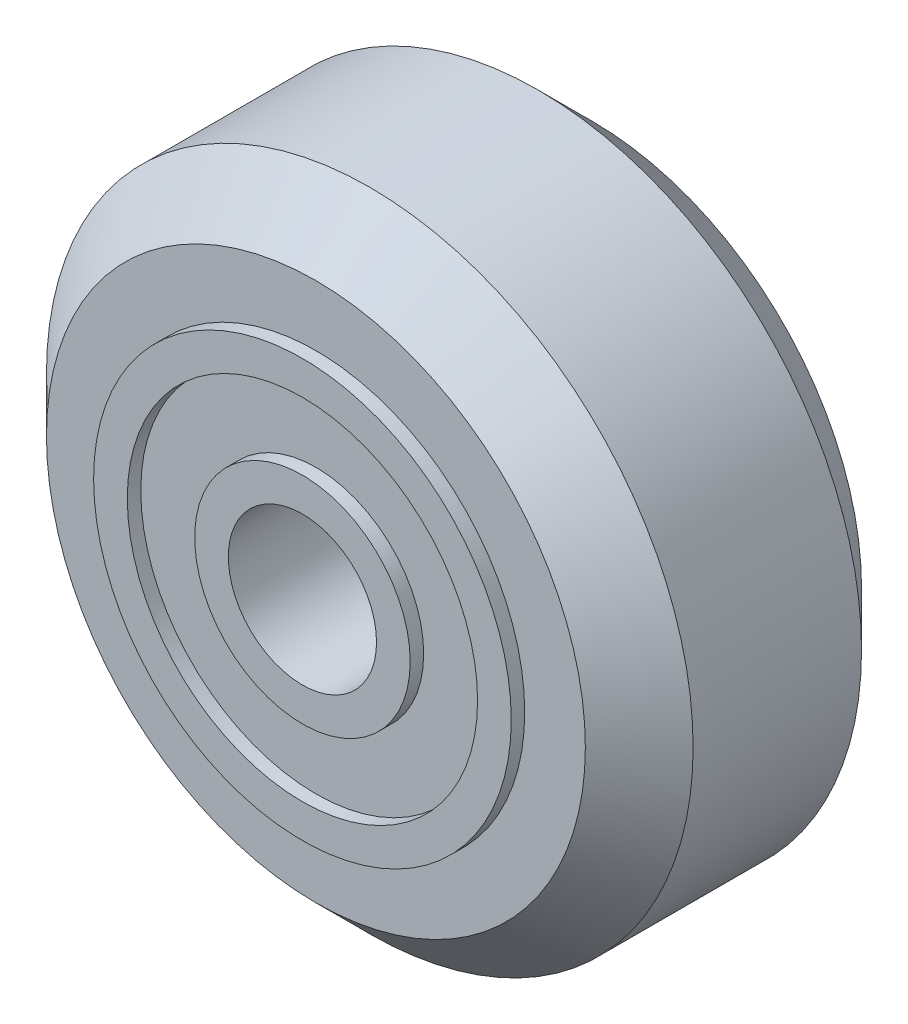
from build123d import *

# Parameters (mm, degrees)
SKETCH1_R                = 12
SKETCH1_R_2              = 7.75
BOSS_EXTRUDE1_DEPTH      = 5.125
CHAMFER1_SIZE            = 2
BOSS_EXTRUDE2_DEPTH      = 0.5
BOSS_EXTRUDE2_DEPTH_BACK = 10.5
SKETCH2_R                = 7.75
SKETCH2_R_2              = 6.5
SKETCH3_R                = 6.5
SKETCH3_R_2              = 4
BOSS_EXTRUDE3_DEPTH      = 10.25
SKETCH4_R                = 4
SKETCH4_R_2              = 2.75
BOSS_EXTRUDE4_DEPTH      = 11


with BuildPart() as part:
    # Sketch1 → Boss-Extrude1 (new, symmetric)
    with BuildSketch(Plane.XY):
        Circle(SKETCH1_R)
        Circle(SKETCH1_R_2, mode=Mode.SUBTRACT)
    extrude(amount=BOSS_EXTRUDE1_DEPTH, both=True)

    # Chamfer1
    chamfer1_edges = [part.edges().sort_by_distance(p)[0] for p in [
        (-12, 0, -5.125),
        (-12, 0, 5.125),
    ]]
    chamfer(chamfer1_edges, length=CHAMFER1_SIZE)

    # Sketch2 → Boss-Extrude2 (add, two sides: drawn at the far end of the back side and taken through both)
    with BuildSketch(Plane.XY.offset(5.125).offset(-BOSS_EXTRUDE2_DEPTH_BACK)):
        Circle(SKETCH2_R)
        Circle(SKETCH2_R_2, mode=Mode.SUBTRACT)
    extrude(amount=BOSS_EXTRUDE2_DEPTH + BOSS_EXTRUDE2_DEPTH_BACK)

    # Sketch3 → Boss-Extrude3 (add)
    with BuildSketch(Plane.XY.offset(5.125)):
        Circle(SKETCH3_R)
        Circle(SKETCH3_R_2, mode=Mode.SUBTRACT)
    extrude(amount=-BOSS_EXTRUDE3_DEPTH)

    # Sketch4 → Boss-Extrude4 (add)
    with BuildSketch(Plane.XY.offset(5.625)):
        Circle(SKETCH4_R)
        Circle(SKETCH4_R_2, mode=Mode.SUBTRACT)
    extrude(amount=-BOSS_EXTRUDE4_DEPTH)


solid = part.part
